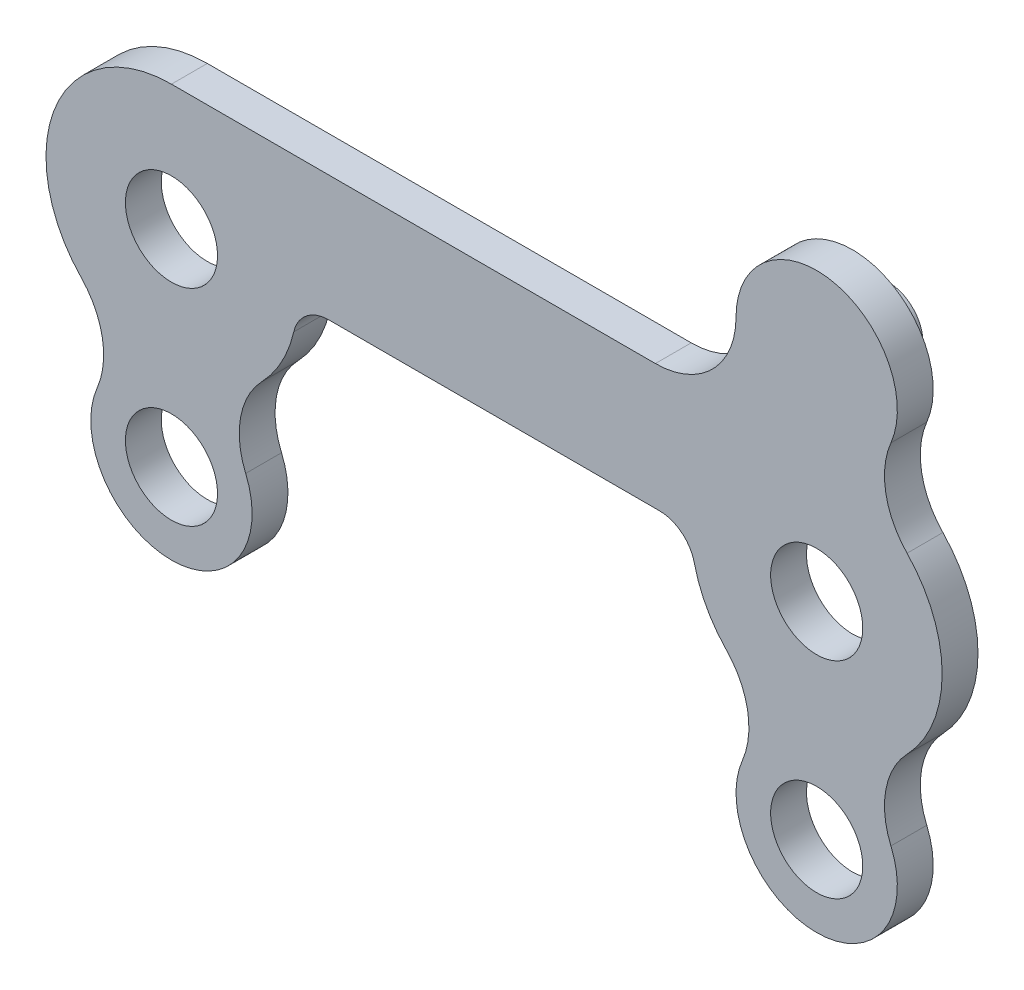
from build123d import *

# Parameters (mm, degrees)
SKETCH2_R                = 2.0399375
SKETCH2_R_2              = 1.5319375
BOSS_EXTRUDE1_DEPTH      = 1.5875
BOSS_EXTRUDE3_DEPTH      = 1.5875
BOSS_EXTRUDE3_DEPTH_BACK = 1.5875
SKETCH2_4_R              = 1.5319375
FILLET1_R                = 1.5875


with BuildPart() as part:
    # Sketch2 → Boss-Extrude1 (new body)
    with BuildSketch(Plane.XY):
        with BuildLine():
            Line((21.43125, 5.55625), (0, 5.55625))
            ThreePointArc((0, 5.55625), (-5.113202022, 2.174184709), (-4.001636229, -3.854714199))
            ThreePointArc((-4.001636229, -3.854714199), (-3.061446645, -5.685103398), (-3.287058415, -7.730434766))
            ThreePointArc((-3.287058415, -7.730434766), (0, -12.7), (3.287058415, -7.730434766))
            ThreePointArc((3.287058415, -7.730434766), (3.061446641, -5.685103418), (4.0016362, -3.854714229))
            ThreePointArc((4.0016362, -3.854714229), (5.152960566, -2.078199091), (5.55625, 0))
            Line((5.55625, 0), (23.01875, 0))
            ThreePointArc((23.01875, 0), (23.422039385, -2.07819897), (24.573363619, -3.854714041))
            ThreePointArc((24.573363619, -3.854714041), (25.513553344, -5.685103337), (25.287941547, -7.730434854))
            ThreePointArc((25.287941547, -7.730434854), (28.575000048, -12.7), (31.862058415, -7.730434766))
            ThreePointArc((31.862058415, -7.730434766), (31.636446655, -5.685103342), (32.576636308, -3.854714117))
            ThreePointArc((32.576636308, -3.854714117), (34.13125, -7.3e-08), (32.576636409, 3.854714012))
            ThreePointArc((32.576636409, 3.854714012), (31.636446674, 5.685103241), (31.862058392, 7.730434711))
            ThreePointArc((31.862058392, 7.730434711), (29.288207306, 12.628071622), (25.003125, 9.128125))
            ThreePointArc((25.003125, 9.128125), (23.956947034, 6.602427966), (21.43125, 5.55625))
        make_face()
        Circle(SKETCH2_R, mode=Mode.SUBTRACT)
        with Locations((28.575, 0)):
            Circle(SKETCH2_R, mode=Mode.SUBTRACT)
        with Locations((28.575, 9.128125)):
            Circle(SKETCH2_R_2, mode=Mode.SUBTRACT)
        with Locations((0, -9.128125)):
            Circle(SKETCH2_R, mode=Mode.SUBTRACT)
        with Locations((28.575, -9.128125)):
            Circle(SKETCH2_R, mode=Mode.SUBTRACT)
    extrude(amount=BOSS_EXTRUDE1_DEPTH)

    # Sketch2<4> → Boss-Extrude3 (add, two sides: drawn at the far end of the back side and taken through both)
    with BuildSketch(Plane.XY.offset(-BOSS_EXTRUDE3_DEPTH_BACK)):
        with Locations((28.575, 9.128125)):
            Circle(SKETCH2_4_R)
    extrude(amount=BOSS_EXTRUDE3_DEPTH + BOSS_EXTRUDE3_DEPTH_BACK)

    # Fillet1
    fillet1_edges = [part.edges().sort_by_distance(p)[0] for p in [
        (23.01875, 0, 0.79375),
        (5.55625, 0, 0.79375),
    ]]
    fillet(fillet1_edges, radius=FILLET1_R)


solid = part.part
